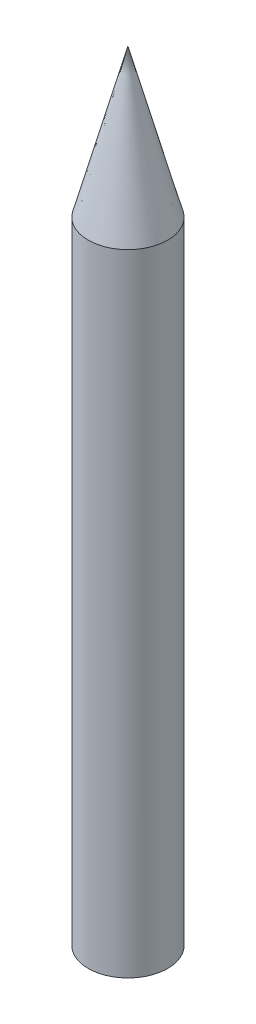
from build123d import *


with BuildPart() as part:
    # Sketch1 → Revolve1 (revolve)
    with BuildSketch(Plane(origin=(0, 0, 0), x_dir=(0, 0, -1), z_dir=(1, 0, 0))):
        Polygon((0, 0), (0, -10), (0.51, -10), (0.51, -1.903345912), align=None)
    revolve(axis=Axis((0, 0, 0), (0, -1, 0)))


solid = part.part
